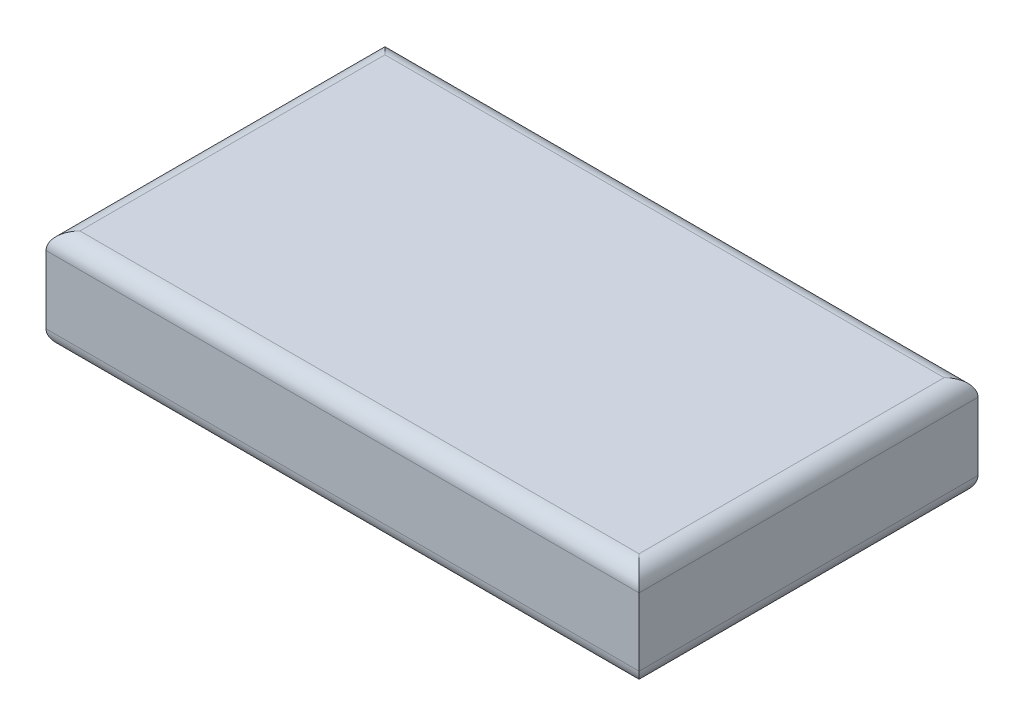
from build123d import *

# Parameters (mm, degrees)
SKETCH1_W           = 35
SKETCH1_H           = 20
BOSS_EXTRUDE1_DEPTH = 6
FILLET1_R           = 1


with BuildPart() as part:
    # Sketch1 → Boss-Extrude1 (new body)
    with BuildSketch(Plane(origin=(0, 0, 0), x_dir=(1, 0, 0), z_dir=(0, 1, 0))):
        Rectangle(SKETCH1_W, SKETCH1_H)
    extrude(amount=BOSS_EXTRUDE1_DEPTH)

    # Fillet1
    fillet1_edges = [part.edges().sort_by_distance(p)[0] for p in [
        (-17.5, 6, 0),
        (0, 6, 10),
        (17.5, 6, 0),
        (0, 0, 10),
        (-17.5, 0, 0),
        (0, 0, -10),
        (17.5, 0, 0),
        (0, 6, -10),
    ]]
    fillet(fillet1_edges, radius=FILLET1_R)


solid = part.part
